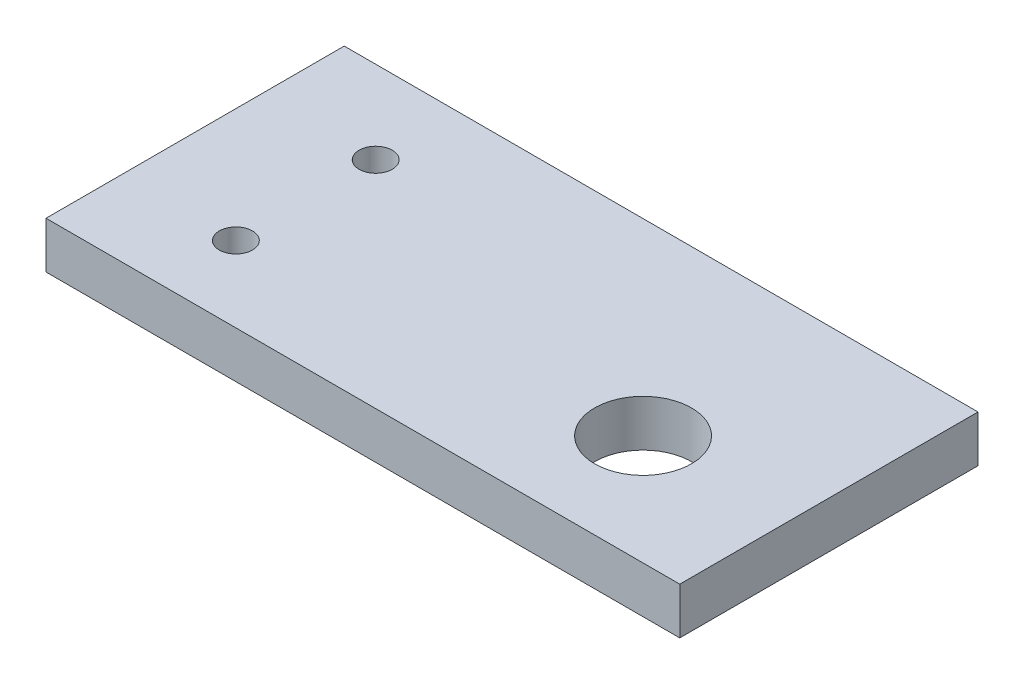
from build123d import *

# Parameters (mm, degrees)
SKETCH1_W           = 43.18
SKETCH1_H           = 20.32
SKETCH1_R           = 3.3
BOSS_EXTRUDE1_DEPTH = 3.175
SKETCH2_R           = 1.1303
CUT_EXTRUDE1_DEPTH  = 48.827768346


with BuildPart() as part:
    # Sketch1 → Boss-Extrude1 (new body)
    with BuildSketch(Plane(origin=(0, 0, 0), x_dir=(1, 0, 0), z_dir=(0, 1, 0))):
        with Locations((21.59, 10.16)):
            Rectangle(SKETCH1_W, SKETCH1_H)
        with Locations(Location((33.18, 7.5, 0), (0, 0, 270))):
            Circle(SKETCH1_R, mode=Mode.SUBTRACT)
    extrude(amount=BOSS_EXTRUDE1_DEPTH)

    # Sketch2 → Cut-Extrude1 (cut, through all)
    with BuildSketch(Plane(origin=(0, 3.175, 0), x_dir=(1, 0, 0), z_dir=(0, 1, 0))):
        with Locations(Location((7.779999934, 5.1562, 0), (0, 0, 270))):
            Circle(SKETCH2_R)
        with Locations(Location((7.779999934, 14.6812, 0), (0, 0, 270))):
            Circle(SKETCH2_R)
    extrude(amount=-CUT_EXTRUDE1_DEPTH, mode=Mode.SUBTRACT)


solid = part.part
